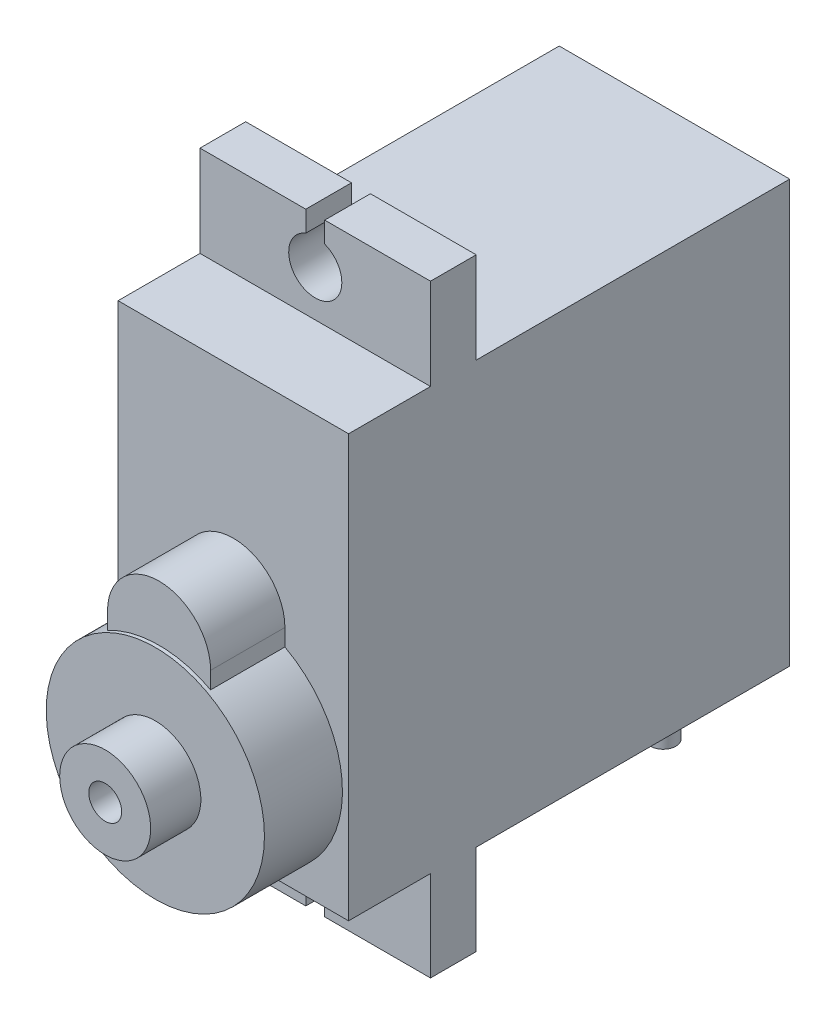
from build123d import *

# Parameters (mm, degrees)
SKETCH1_W                = 12.41
SKETCH1_H                = 23.75
BOSS_EXTRUDE1_DEPTH      = 22.71
SKETCH2_R                = 5.875
BOSS_EXTRUDE3_DEPTH      = 4.2
BOSS_EXTRUDE4_DEPTH      = 4
BOSS_EXTRUDE5_DEPTH      = 4.87
BOSS_EXTRUDE5_DEPTH_BACK = 27.62
SKETCH6_W                = 12.41
SKETCH6_H                = 2.46
SKETCH8_R                = 1.43
CUT_EXTRUDE1_DEPTH       = 36.929209565
SKETCH9_W                = 1.02
SKETCH9_H                = 2.455
CUT_EXTRUDE2_DEPTH       = 36.929209565
SKETCH10_R               = 2.45
SKETCH10_R_2             = 0.885
BOSS_EXTRUDE7_DEPTH      = 2.7
BOSS_EXTRUDE8_DEPTH      = 5


with BuildPart() as part:
    # Sketch1 → Boss-Extrude1 (new body)
    with BuildSketch(Plane(origin=(0, 0, 0), x_dir=(1, 0, 0), z_dir=(0, 1, 0))):
        with Locations((6.205, 11.875)):
            Rectangle(SKETCH1_W, SKETCH1_H)
    extrude(amount=BOSS_EXTRUDE1_DEPTH)

    # Sketch2 → Boss-Extrude3 (add)
    with BuildSketch(Plane.XY):
        with Locations((6.205, 5.875)):
            Circle(SKETCH2_R)
    extrude(amount=BOSS_EXTRUDE3_DEPTH)

    # Sketch4 → Boss-Extrude4 (add)
    with BuildSketch(Plane.XY):
        with BuildLine():
            Line((3.43, 11.965), (3.43, 11.053320191))
            Line((3.43, 11.053320191), (8.98, 11.053320191))
            Line((8.98, 11.053320191), (8.98, 11.965))
            ThreePointArc((8.98, 11.965), (6.205, 14.74), (3.43, 11.965))
        make_face()
    extrude(amount=BOSS_EXTRUDE4_DEPTH)

    # Sketch6 → Boss-Extrude5 (add, two sides: drawn at the far end of the back side and taken through both)
    with BuildSketch(Plane.XZ.offset(-BOSS_EXTRUDE5_DEPTH_BACK)):
        with Locations((6.205, -5.64)):
            Rectangle(SKETCH6_W, SKETCH6_H)
    extrude(amount=BOSS_EXTRUDE5_DEPTH + BOSS_EXTRUDE5_DEPTH_BACK)

    # Sketch8 → Cut-Extrude1 (cut, through all)
    with BuildSketch(Plane.XY.offset(-4.41)):
        with Locations((6.205, 25.165)):
            Circle(SKETCH8_R)
        with Locations((6.205, -2.415)):
            Circle(SKETCH8_R)
    extrude(amount=-CUT_EXTRUDE1_DEPTH, mode=Mode.SUBTRACT)

    # Sketch9 → Cut-Extrude2 (cut, through all)
    with BuildSketch(Plane.XY.offset(-4.41)):
        with Locations((6.205, 26.3925)):
            Rectangle(SKETCH9_W, SKETCH9_H)
        with Locations((6.205, -3.6425)):
            Rectangle(SKETCH9_W, SKETCH9_H)
    extrude(amount=-CUT_EXTRUDE2_DEPTH, mode=Mode.SUBTRACT)

    # Sketch10 → Boss-Extrude7 (add)
    with BuildSketch(Plane.XY.offset(4.2)):
        with Locations((6.205, 5.875)):
            Circle(SKETCH10_R)
        with Locations((6.205, 5.875)):
            Circle(SKETCH10_R_2, mode=Mode.SUBTRACT)
    extrude(amount=BOSS_EXTRUDE7_DEPTH)

    # Sketch12 → Boss-Extrude8 (add)
    with BuildSketch(Plane.XZ):
        with BuildLine():
            ThreePointArc((5.61, -22.289411255), (6.205, -22.635), (6.8, -22.289411255))
            ThreePointArc((6.8, -22.289411255), (8.08, -21.95), (6.8, -21.610588745))
            ThreePointArc((6.8, -21.610588745), (6.205, -21.265), (5.61, -21.610588745))
            ThreePointArc((5.61, -21.610588745), (4.33, -21.95), (5.61, -22.289411255))
        make_face()
    extrude(amount=BOSS_EXTRUDE8_DEPTH)


solid = part.part
